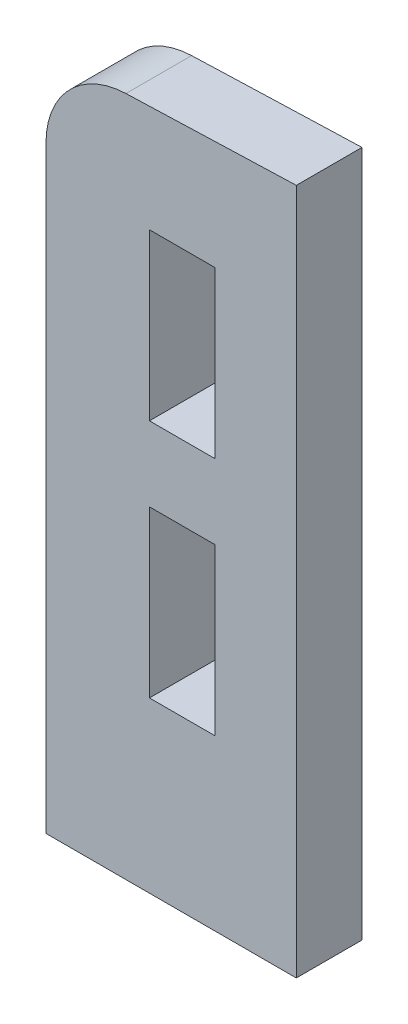
from build123d import *

# Parameters (mm, degrees)
SKETCH1_W                = 6.266
SKETCH1_H                = 19.6
SKETCH1_R                = 1.675
SKETCH1_W_2              = 52.832
SKETCH1_H_2              = 5
BOSS_EXTRUDE2_DEPTH      = 3.175
SKETCH3_W                = 30
SKETCH3_H                = 29.6
BOSS_EXTRUDE3_DEPTH      = 3.175
SKETCH4_R                = 4.85
CUT_EXTRUDE1_DEPTH       = 10
BOSS_EXTRUDE14_DEPTH     = 3.175
CUT_EXTRUDE8_DEPTH       = 10
BOSS_EXTRUDE15_DEPTH     = 3.175
BOSS_EXTRUDE16_DEPTH     = 3.175
BOSS_EXTRUDE17_DEPTH     = 3.175
FILLET5_R                = 4
SKETCH27_W               = 3.175
SKETCH27_H               = 8
CUT_EXTRUDE9_DEPTH       = 10
SKETCH28_W               = 18
SKETCH28_H               = 3.175
BOSS_EXTRUDE18_DEPTH     = 3.175
CUT_EXTRUDE10_DEPTH      = 53.993803893
CUT_EXTRUDE10_DEPTH_BACK = 53.993803893
SKETCH29_W               = 80.680500577
SKETCH29_H               = 41.601075076


with BuildPart() as part:
    # Sketch1 → Boss-Extrude2 (new body)
    # profile 1 of 4: a face of its own
    with BuildSketch(Plane.XY):
        with Locations((-23.283, 0)):
            Rectangle(SKETCH1_W, SKETCH1_H)
        with Locations((-23.95, -4.974)):
            Circle(SKETCH1_R, mode=Mode.SUBTRACT)
        with Locations((-23.95, 4.974)):
            Circle(SKETCH1_R, mode=Mode.SUBTRACT)
    # profile 2 of 4: a face of its own
    with BuildSketch(Plane.XY):
        with Locations((23.283, 0)):
            Rectangle(SKETCH1_W, SKETCH1_H)
        with Locations((23.95, -4.974)):
            Circle(SKETCH1_R, mode=Mode.SUBTRACT)
        with Locations((23.95, 4.974)):
            Circle(SKETCH1_R, mode=Mode.SUBTRACT)
    # profile 3 of 4: a face of its own
    with BuildSketch(Plane.XY):
        with Locations((0, 12.3)):
            Rectangle(SKETCH1_W_2, SKETCH1_H_2)
    # profile 4 of 4: a face of its own
    with BuildSketch(Plane.XY):
        with Locations((0, -12.3)):
            Rectangle(SKETCH1_W_2, SKETCH1_H_2)
    extrude(amount=BOSS_EXTRUDE2_DEPTH)

    # Sketch3 → Boss-Extrude3 (add)
    with BuildSketch(Plane.XY.offset(3.175)):
        with Locations((41.416, 0)):
            Rectangle(SKETCH3_W, SKETCH3_H)
    extrude(amount=-BOSS_EXTRUDE3_DEPTH)

    # Sketch4 → Cut-Extrude1 (cut)
    with BuildSketch(Plane(origin=(0, 0, 0), x_dir=(-1, 0, 0), z_dir=(0, 0, -1))):
        with Locations((-40.576, 7.77)):
            Circle(SKETCH4_R)
    extrude(amount=-CUT_EXTRUDE1_DEPTH, mode=Mode.SUBTRACT)

    # Sketch22 → Boss-Extrude14 (add)
    with BuildSketch(Plane(origin=(0, 0, 0), x_dir=(-1, 0, 0), z_dir=(0, 0, -1))):
        with BuildLine():
            ThreePointArc((-34.680262133, 14.8), (-40.576, 16.945), (-46.471737867, 14.8))
            Line((-46.471737867, 14.8), (-34.680262133, 14.8))
        make_face()
    extrude(amount=-BOSS_EXTRUDE14_DEPTH)

    # Sketch23 → Cut-Extrude8 (cut)
    with BuildSketch(Plane(origin=(0, 0, 0), x_dir=(-1, 0, 0), z_dir=(0, 0, -1))):
        with BuildLine():
            Line((-49.751, -14.8), (-49.751, 7.77))
            ThreePointArc((-49.751, 7.77), (-48.890866804, 11.648609936), (-46.471737867, 14.8))
            Line((-46.471737867, 14.8), (-56.416, 14.8))
            Line((-56.416, 14.8), (-56.416, -14.8))
            Line((-56.416, -14.8), (-49.751, -14.8))
        make_face()
    extrude(amount=-CUT_EXTRUDE8_DEPTH, mode=Mode.SUBTRACT)

    # Sketch24 → Boss-Extrude15 (add)
    with BuildSketch(Plane(origin=(0, 0, 0), x_dir=(-1, 0, 0), z_dir=(0, 0, -1))):
        Polygon((30.625, 14.8), (26.416, 14.8), (26.416, -14.8), (27.751006616, -14.8), (30.625, -14.8), align=None)
    extrude(amount=-BOSS_EXTRUDE15_DEPTH)

    # Sketch25 → Boss-Extrude16 (add)
    with BuildSketch(Plane(origin=(0, 0, 0), x_dir=(-1, 0, 0), z_dir=(0, 0, -1))):
        Polygon((30.625, 14.8), (30.625, 9.8), (33.8, 9.8), (33.8, 1.8), (30.625, 1.8), (30.625, -1.8), (33.8, -1.8), (33.8, -9.8), (30.625, -9.8), (30.625, -14.8), (31.879074074, -14.8), (38.8, -14.8), (38.8, 14.8), align=None)
    extrude(amount=-BOSS_EXTRUDE16_DEPTH)

    # Sketch26 → Boss-Extrude17 (add)
    with BuildSketch(Plane(origin=(0, 0, 0), x_dir=(-1, 0, 0), z_dir=(0, 0, -1))):
        with BuildLine():
            ThreePointArc((-40.225848077, 16.938316019), (-37.275108655, 16.330650754), (-34.680262133, 14.8))
            Line((-34.680262133, 14.8), (38.8, 14.8))
            ThreePointArc((38.8, 14.8), (-0.708684686, 16.025831975), (-40.225848077, 16.938316019))
        make_face()
    extrude(amount=-BOSS_EXTRUDE17_DEPTH)

    # Fillet5
    fillet5_edges = [part.edges().sort_by_distance(p)[0] for p in [
        (-38.8, 14.8, 1.5875),
    ]]
    fillet(fillet5_edges, radius=FILLET5_R)

    # Sketch27 → Cut-Extrude9 (cut)
    with BuildSketch(Plane(origin=(0, 0, 0), x_dir=(-1, 0, 0), z_dir=(0, 0, -1))):
        with Locations((-43.1635, -5.8)):
            Rectangle(SKETCH27_W, SKETCH27_H)
    extrude(amount=-CUT_EXTRUDE9_DEPTH, mode=Mode.SUBTRACT)

    # Sketch28 → Boss-Extrude18 (add)
    with BuildSketch(Plane(origin=(0, 0, 0), x_dir=(-1, 0, 0), z_dir=(0, 0, -1))):
        with Locations((-40.751, -16.3875)):
            Rectangle(SKETCH28_W, SKETCH28_H)
        with Locations((-5.45, -16.3875)):
            Rectangle(SKETCH28_W, SKETCH28_H)
        with Locations((29.8, -16.3875)):
            Rectangle(SKETCH28_W, SKETCH28_H)
    extrude(amount=-BOSS_EXTRUDE18_DEPTH)

    # Sketch29 → Cut-Extrude10 (cut, two sides: drawn at the far end of the back side and taken through both)
    with BuildSketch(Plane(origin=(0, 0, 0), x_dir=(-1, 0, 0), z_dir=(0, 0, -1)).offset(-CUT_EXTRUDE10_DEPTH_BACK)):
        with Locations((-13.640250288, -3.363421895)):
            Rectangle(SKETCH29_W, SKETCH29_H)
    extrude(amount=CUT_EXTRUDE10_DEPTH + CUT_EXTRUDE10_DEPTH_BACK, mode=Mode.SUBTRACT)


solid = part.part
